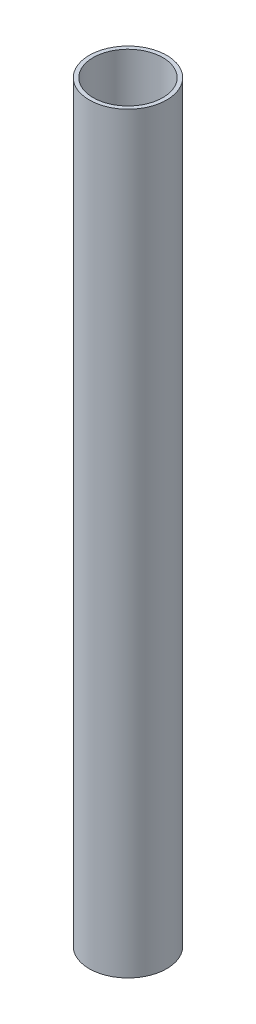
from build123d import *

# Parameters (mm, degrees)
SKETCH_1_R      = 12.35
SKETCH_1_R_2    = 11.1
EXTRUDE_1_DEPTH = 240


with BuildPart() as part:
    # Эскиз1 → Вытянуть1 (new body)
    with BuildSketch(Plane(origin=(0, 0, 0), x_dir=(1, 0, 0), z_dir=(0, 1, 0))):
        with Locations(Location((0, 0, 0), (0, 0, 270))):
            Circle(SKETCH_1_R)
        with Locations(Location((0, 0, 0), (0, 0, 270))):
            Circle(SKETCH_1_R_2, mode=Mode.SUBTRACT)
    extrude(amount=EXTRUDE_1_DEPTH)


solid = part.part
